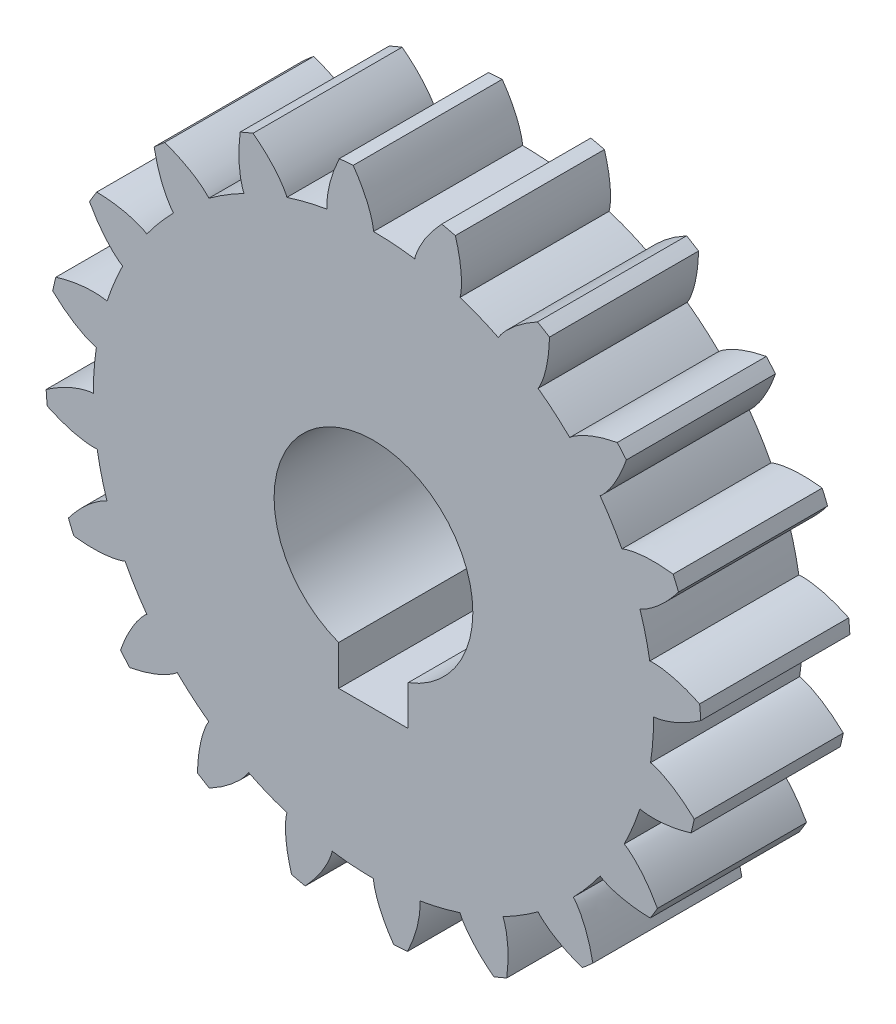
from build123d import *

# Parameters (mm, degrees)
BOSS_EXTRUDE1_DEPTH = 15


with BuildPart() as part:
    # Sketch2 → Boss-Extrude1 (new body)
    with BuildSketch(Plane.XY):
        with BuildLine():
            ThreePointArc((-4.15371806, -27.882301309), (-2.082549652, -28.112970084), (0, -28.19))
            add(Edge.make_bspline(
                [(0, -28.19), (0.00050941, -28.212977148), (0.003524206, -28.277366151), (0.015448979, -28.398790812), (0.043740646, -28.596006057), (0.115099943, -28.959915934), (0.262171531, -29.504037494), (0.472121052, -30.090958528), (0.736277742, -30.698626173), (0.995999295, -31.222666633), (1.218164991, -31.634423263), (1.500300211, -32.118998732), (1.738231713, -32.493616494), (1.920656813, -32.7647313), (2.040591108, -32.936848482)],
                knots=[0, 0, 0, 0, 0, 0.005376748, 0.015083688, 0.02853182, 0.046610139, 0.092110525, 0.146842495, 0.174208853, 0.201574955, 0.228941013, 0.256307345, 0.305396491, 0.305396491, 0.305396491, 0.305396491, 0.305396491], degree=4))
            ThreePointArc((2.040591108, -32.936848482), (2.740354915, -32.886022182), (3.438880021, -32.820330653))
            add(Edge.make_bspline(
                [(4.665684319, -27.801213819), (4.668984848, -27.823958387), (4.676668557, -27.887958335), (4.685005058, -28.009682002), (4.689744378, -28.208859838), (4.679599416, -28.579561371), (4.624612923, -29.140520203), (4.514699363, -29.754095064), (4.354759979, -30.397102154), (4.185353556, -30.956901361), (4.034401106, -31.399749503), (3.836358346, -31.924337658), (3.663710728, -32.333168513), (3.52867337, -32.630737105), (3.438880021, -32.820330653)],
                knots=[0, 0, 0, 0, 0, 0.005376748, 0.015083688, 0.02853182, 0.046610139, 0.092110525, 0.146842495, 0.174208853, 0.201574955, 0.228941013, 0.256307345, 0.305396491, 0.305396491, 0.305396491, 0.305396491, 0.305396491], degree=4))
            ThreePointArc((4.665684319, -27.801213819), (6.706763102, -27.380566625), (8.711189071, -26.810283194))
            add(Edge.make_bspline(
                [(8.711189071, -26.810283194), (8.718773878, -26.831978344), (8.741538416, -26.892284302), (8.790401833, -27.004081059), (8.878251669, -27.182901298), (9.05857273, -27.506948922), (9.366588932, -27.978991658), (9.747631365, -28.472308761), (10.186638936, -28.968606128), (10.595586219, -29.386739849), (10.934118148, -29.709690699), (11.352186743, -30.083364779), (11.694236303, -30.366122565), (11.951511966, -30.567595612), (12.118763392, -30.694227044)],
                knots=[0, 0, 0, 0, 0, 0.005376748, 0.015083688, 0.02853182, 0.046610139, 0.092110525, 0.146842495, 0.174208853, 0.201574955, 0.228941013, 0.256307345, 0.305396491, 0.305396491, 0.305396491, 0.305396491, 0.305396491], degree=4))
            ThreePointArc((12.118763392, -30.694227044), (12.768572131, -30.429649451), (13.412609185, -30.151316967))
            add(Edge.make_bspline(
                [(13.028377009, -24.998749819), (13.038544456, -25.019361268), (13.065629169, -25.077854439), (13.111172335, -25.191044406), (13.177229032, -25.379009254), (13.282133674, -25.734702329), (13.403184223, -26.285197642), (13.488255275, -26.90270717), (13.534844, -27.56366724), (13.546716386, -28.148417387), (13.539999676, -28.616237871), (13.513756474, -29.176349433), (13.475894514, -29.618521729), (13.439420107, -29.943255116), (13.412609185, -30.151316967)],
                knots=[0, 0, 0, 0, 0, 0.005376748, 0.015083688, 0.02853182, 0.046610139, 0.092110525, 0.146842495, 0.174208853, 0.201574955, 0.228941013, 0.256307345, 0.305396491, 0.305396491, 0.305396491, 0.305396491, 0.305396491], degree=4))
            ThreePointArc((13.028377009, -24.998749819), (14.839571154, -23.967962533), (16.569666262, -22.806189071))
            add(Edge.make_bspline(
                [(16.569666262, -22.806189071), (16.583584012, -22.824478551), (16.62386994, -22.874798296), (16.704888909, -22.966023704), (16.843697561, -23.108944765), (17.115329303, -23.361410097), (17.554139346, -23.715167176), (18.068975605, -24.066591035), (18.639860936, -24.402937079), (19.15800334, -24.674234219), (19.579763639, -24.87676661), (20.09284214, -25.102961479), (20.505527565, -25.266180987), (20.812469856, -25.378290689), (21.010666679, -25.447040804)],
                knots=[0, 0, 0, 0, 0, 0.005376748, 0.015083688, 0.02853182, 0.046610139, 0.092110525, 0.146842495, 0.174208853, 0.201574955, 0.228941013, 0.256307345, 0.305396491, 0.305396491, 0.305396491, 0.305396491, 0.305396491], degree=4))
            ThreePointArc((21.010666679, -25.447040804), (21.546912542, -24.994610617), (22.073418712, -24.530882299))
            add(Edge.make_bspline(
                [(20.115761383, -19.74923401), (20.131800488, -19.765694749), (20.175634965, -19.812955423), (20.253926713, -19.906531867), (20.374834697, -20.064884419), (20.584520146, -20.370751318), (20.869758466, -20.856896796), (21.141486783, -21.417894855), (21.390043188, -22.032108529), (21.582032231, -22.584570198), (21.72020874, -23.031569495), (21.868333963, -23.572376841), (21.968963853, -24.004607674), (22.034622766, -24.32471869), (22.073418712, -24.530882299)],
                knots=[0, 0, 0, 0, 0, 0.005376748, 0.015083688, 0.02853182, 0.046610139, 0.092110525, 0.146842495, 0.174208853, 0.201574955, 0.228941013, 0.256307345, 0.305396491, 0.305396491, 0.305396491, 0.305396491, 0.305396491], degree=4))
            ThreePointArc((20.115761383, -19.74923401), (21.519778588, -18.209207273), (22.806189071, -16.569666262))
            add(Edge.make_bspline(
                [(22.806189071, -16.569666262), (22.825077398, -16.58275977), (22.878941249, -16.618167654), (22.984185069, -16.679891935), (23.160364978, -16.772923709), (23.496718195, -16.929093684), (24.023368295, -17.129936898), (24.621602618, -17.305067696), (25.268483476, -17.448538524), (25.845101612, -17.546442628), (26.308805444, -17.608731279), (26.866670155, -17.665305406), (27.309594919, -17.693009573), (27.636158188, -17.704781852), (27.845899522, -17.70892091)],
                knots=[0, 0, 0, 0, 0, 0.005376748, 0.015083688, 0.02853182, 0.046610139, 0.092110525, 0.146842495, 0.174208853, 0.201574955, 0.228941013, 0.256307345, 0.305396491, 0.305396491, 0.305396491, 0.305396491, 0.305396491], degree=4))
            ThreePointArc((27.845899522, -17.70892091), (28.216091028, -17.112925148), (28.57352822, -16.509193955))
            add(Edge.make_bspline(
                [(25.234074879, -12.566525574), (25.254415622, -12.577224312), (25.310709039, -12.608626286), (25.414085627, -12.673429291), (25.578009583, -12.786668896), (25.871950365, -13.012769237), (26.293455343, -13.386977573), (26.725242263, -13.836549765), (27.151435915, -14.343893529), (27.50474839, -14.809987922), (27.774292439, -15.192410627), (28.082286558, -15.660975766), (28.311557943, -16.04095537), (28.472923024, -16.325109318), (28.57352822, -16.509193955)],
                knots=[0, 0, 0, 0, 0, 0.005376748, 0.015083688, 0.02853182, 0.046610139, 0.092110525, 0.146842495, 0.174208853, 0.201574955, 0.228941013, 0.256307345, 0.305396491, 0.305396491, 0.305396491, 0.305396491, 0.305396491], degree=4))
            ThreePointArc((25.234074879, -12.566525574), (26.093480157, -10.668007935), (26.810283194, -8.711189071))
            add(Edge.make_bspline(
                [(26.810283194, -8.711189071), (26.832293177, -8.717804923), (26.894462381, -8.734834977), (27.013629054, -8.761016128), (27.209934504, -8.795052017), (27.578084598, -8.839639629), (28.141022575, -8.867909045), (28.764095618, -8.849603759), (29.423650798, -8.786155447), (30.002301266, -8.70108298), (30.462558068, -8.617030642), (31.010601303, -8.498446158), (31.440408845, -8.387923108), (31.754626804, -8.29820561), (31.955381706, -8.237328452)],
                knots=[0, 0, 0, 0, 0, 0.005376748, 0.015083688, 0.02853182, 0.046610139, 0.092110525, 0.146842495, 0.174208853, 0.201574955, 0.228941013, 0.256307345, 0.305396491, 0.305396491, 0.305396491, 0.305396491, 0.305396491], degree=4))
            ThreePointArc((31.955381706, -8.237328452), (32.12328193, -7.556107332), (32.276661703, -6.871470681))
            add(Edge.make_bspline(
                [(27.882301309, -4.15371806), (27.904952597, -4.157607528), (27.968194561, -4.170076958), (28.086536769, -4.199763156), (28.277430678, -4.256805132), (28.626853822, -4.381006637), (29.143365613, -4.606647712), (29.692944825, -4.900786779), (30.25505692, -5.25159829), (30.73510814, -5.585700841), (31.109634878, -5.866112755), (31.547349284, -6.216569267), (31.882819484, -6.507102591), (32.124095194, -6.727484502), (32.276661703, -6.871470681)],
                knots=[0, 0, 0, 0, 0, 0.005376748, 0.015083688, 0.02853182, 0.046610139, 0.092110525, 0.146842495, 0.174208853, 0.201574955, 0.228941013, 0.256307345, 0.305396491, 0.305396491, 0.305396491, 0.305396491, 0.305396491], degree=4))
            ThreePointArc((27.882301309, -4.15371806), (28.112970084, -2.082549652), (28.19, 0))
            add(Edge.make_bspline(
                [(28.19, 0), (28.212977148, 0.00050941), (28.277366151, 0.003524206), (28.398790812, 0.015448979), (28.596006057, 0.043740646), (28.959915934, 0.115099943), (29.504037494, 0.262171531), (30.090958528, 0.472121052), (30.698626173, 0.736277742), (31.222666633, 0.995999295), (31.634423263, 1.218164991), (32.118998732, 1.500300211), (32.493616494, 1.738231713), (32.7647313, 1.920656813), (32.936848482, 2.040591108)],
                knots=[0, 0, 0, 0, 0, 0.005376748, 0.015083688, 0.02853182, 0.046610139, 0.092110525, 0.146842495, 0.174208853, 0.201574955, 0.228941013, 0.256307345, 0.305396491, 0.305396491, 0.305396491, 0.305396491, 0.305396491], degree=4))
            ThreePointArc((32.936848482, 2.040591108), (32.886022182, 2.740354915), (32.820330653, 3.438880021))
            add(Edge.make_bspline(
                [(27.801213819, 4.665684319), (27.823958387, 4.668984848), (27.887958335, 4.676668557), (28.009682002, 4.685005058), (28.208859838, 4.689744378), (28.579561371, 4.679599416), (29.140520203, 4.624612923), (29.754095064, 4.514699363), (30.397102154, 4.354759979), (30.956901361, 4.185353556), (31.399749503, 4.034401106), (31.924337658, 3.836358346), (32.333168513, 3.663710728), (32.630737105, 3.52867337), (32.820330653, 3.438880021)],
                knots=[0, 0, 0, 0, 0, 0.005376748, 0.015083688, 0.02853182, 0.046610139, 0.092110525, 0.146842495, 0.174208853, 0.201574955, 0.228941013, 0.256307345, 0.305396491, 0.305396491, 0.305396491, 0.305396491, 0.305396491], degree=4))
            ThreePointArc((27.801213819, 4.665684319), (27.380566625, 6.706763102), (26.810283194, 8.711189071))
            add(Edge.make_bspline(
                [(26.810283194, 8.711189071), (26.831978344, 8.718773878), (26.892284302, 8.741538416), (27.004081059, 8.790401833), (27.182901298, 8.878251669), (27.506948922, 9.05857273), (27.978991658, 9.366588932), (28.472308761, 9.747631365), (28.968606128, 10.186638936), (29.386739849, 10.595586219), (29.709690699, 10.934118148), (30.083364779, 11.352186743), (30.366122565, 11.694236303), (30.567595612, 11.951511966), (30.694227044, 12.118763392)],
                knots=[0, 0, 0, 0, 0, 0.005376748, 0.015083688, 0.02853182, 0.046610139, 0.092110525, 0.146842495, 0.174208853, 0.201574955, 0.228941013, 0.256307345, 0.305396491, 0.305396491, 0.305396491, 0.305396491, 0.305396491], degree=4))
            ThreePointArc((30.694227044, 12.118763392), (30.429649451, 12.768572131), (30.151316967, 13.412609185))
            add(Edge.make_bspline(
                [(24.998749819, 13.028377009), (25.019361268, 13.038544456), (25.077854439, 13.065629169), (25.191044406, 13.111172335), (25.379009254, 13.177229032), (25.734702329, 13.282133674), (26.285197642, 13.403184223), (26.90270717, 13.488255275), (27.56366724, 13.534844), (28.148417387, 13.546716386), (28.616237871, 13.539999676), (29.176349433, 13.513756474), (29.618521729, 13.475894514), (29.943255116, 13.439420107), (30.151316967, 13.412609185)],
                knots=[0, 0, 0, 0, 0, 0.005376748, 0.015083688, 0.02853182, 0.046610139, 0.092110525, 0.146842495, 0.174208853, 0.201574955, 0.228941013, 0.256307345, 0.305396491, 0.305396491, 0.305396491, 0.305396491, 0.305396491], degree=4))
            ThreePointArc((24.998749819, 13.028377009), (23.967962533, 14.839571154), (22.806189071, 16.569666262))
            add(Edge.make_bspline(
                [(22.806189071, 16.569666262), (22.824478551, 16.583584012), (22.874798296, 16.62386994), (22.966023704, 16.704888909), (23.108944765, 16.843697561), (23.361410097, 17.115329303), (23.715167176, 17.554139346), (24.066591035, 18.068975605), (24.402937079, 18.639860936), (24.674234219, 19.15800334), (24.87676661, 19.579763639), (25.102961479, 20.09284214), (25.266180987, 20.505527565), (25.378290689, 20.812469856), (25.447040804, 21.010666679)],
                knots=[0, 0, 0, 0, 0, 0.005376748, 0.015083688, 0.02853182, 0.046610139, 0.092110525, 0.146842495, 0.174208853, 0.201574955, 0.228941013, 0.256307345, 0.305396491, 0.305396491, 0.305396491, 0.305396491, 0.305396491], degree=4))
            ThreePointArc((25.447040804, 21.010666679), (24.994610617, 21.546912542), (24.530882299, 22.073418712))
            add(Edge.make_bspline(
                [(19.74923401, 20.115761383), (19.765694749, 20.131800488), (19.812955423, 20.175634965), (19.906531867, 20.253926713), (20.064884419, 20.374834697), (20.370751318, 20.584520146), (20.856896796, 20.869758466), (21.417894855, 21.141486783), (22.032108529, 21.390043188), (22.584570198, 21.582032231), (23.031569495, 21.72020874), (23.572376841, 21.868333963), (24.004607674, 21.968963853), (24.32471869, 22.034622766), (24.530882299, 22.073418712)],
                knots=[0, 0, 0, 0, 0, 0.005376748, 0.015083688, 0.02853182, 0.046610139, 0.092110525, 0.146842495, 0.174208853, 0.201574955, 0.228941013, 0.256307345, 0.305396491, 0.305396491, 0.305396491, 0.305396491, 0.305396491], degree=4))
            ThreePointArc((19.74923401, 20.115761383), (18.209207273, 21.519778588), (16.569666262, 22.806189071))
            add(Edge.make_bspline(
                [(16.569666262, 22.806189071), (16.58275977, 22.825077398), (16.618167654, 22.878941249), (16.679891935, 22.984185069), (16.772923709, 23.160364978), (16.929093684, 23.496718195), (17.129936898, 24.023368295), (17.305067696, 24.621602618), (17.448538524, 25.268483476), (17.546442628, 25.845101612), (17.608731279, 26.308805444), (17.665305406, 26.866670155), (17.693009573, 27.309594919), (17.704781852, 27.636158188), (17.70892091, 27.845899522)],
                knots=[0, 0, 0, 0, 0, 0.005376748, 0.015083688, 0.02853182, 0.046610139, 0.092110525, 0.146842495, 0.174208853, 0.201574955, 0.228941013, 0.256307345, 0.305396491, 0.305396491, 0.305396491, 0.305396491, 0.305396491], degree=4))
            ThreePointArc((17.70892091, 27.845899522), (17.112925148, 28.216091028), (16.509193955, 28.57352822))
            add(Edge.make_bspline(
                [(12.566525574, 25.234074879), (12.577224312, 25.254415622), (12.608626286, 25.310709039), (12.673429291, 25.414085627), (12.786668896, 25.578009583), (13.012769237, 25.871950365), (13.386977573, 26.293455343), (13.836549765, 26.725242263), (14.343893529, 27.151435915), (14.809987922, 27.50474839), (15.192410627, 27.774292439), (15.660975766, 28.082286558), (16.04095537, 28.311557943), (16.325109318, 28.472923024), (16.509193955, 28.57352822)],
                knots=[0, 0, 0, 0, 0, 0.005376748, 0.015083688, 0.02853182, 0.046610139, 0.092110525, 0.146842495, 0.174208853, 0.201574955, 0.228941013, 0.256307345, 0.305396491, 0.305396491, 0.305396491, 0.305396491, 0.305396491], degree=4))
            ThreePointArc((12.566525574, 25.234074879), (10.668007935, 26.093480157), (8.711189071, 26.810283194))
            add(Edge.make_bspline(
                [(8.711189071, 26.810283194), (8.717804923, 26.832293177), (8.734834977, 26.894462381), (8.761016128, 27.013629054), (8.795052017, 27.209934504), (8.839639629, 27.578084598), (8.867909045, 28.141022575), (8.849603759, 28.764095618), (8.786155447, 29.423650798), (8.70108298, 30.002301266), (8.617030642, 30.462558068), (8.498446158, 31.010601303), (8.387923108, 31.440408845), (8.29820561, 31.754626804), (8.237328452, 31.955381706)],
                knots=[0, 0, 0, 0, 0, 0.005376748, 0.015083688, 0.02853182, 0.046610139, 0.092110525, 0.146842495, 0.174208853, 0.201574955, 0.228941013, 0.256307345, 0.305396491, 0.305396491, 0.305396491, 0.305396491, 0.305396491], degree=4))
            ThreePointArc((8.237328452, 31.955381706), (7.556107332, 32.12328193), (6.871470681, 32.276661703))
            add(Edge.make_bspline(
                [(4.15371806, 27.882301309), (4.157607528, 27.904952597), (4.170076958, 27.968194561), (4.199763156, 28.086536769), (4.256805132, 28.277430678), (4.381006637, 28.626853822), (4.606647712, 29.143365613), (4.900786779, 29.692944825), (5.25159829, 30.25505692), (5.585700841, 30.73510814), (5.866112755, 31.109634878), (6.216569267, 31.547349284), (6.507102591, 31.882819484), (6.727484502, 32.124095194), (6.871470681, 32.276661703)],
                knots=[0, 0, 0, 0, 0, 0.005376748, 0.015083688, 0.02853182, 0.046610139, 0.092110525, 0.146842495, 0.174208853, 0.201574955, 0.228941013, 0.256307345, 0.305396491, 0.305396491, 0.305396491, 0.305396491, 0.305396491], degree=4))
            ThreePointArc((4.15371806, 27.882301309), (2.082549652, 28.112970084), (0, 28.19))
            add(Edge.make_bspline(
                [(0, 28.19), (-0.00050941, 28.212977148), (-0.003524206, 28.277366151), (-0.015448979, 28.398790812), (-0.043740646, 28.596006057), (-0.115099943, 28.959915934), (-0.262171531, 29.504037494), (-0.472121052, 30.090958528), (-0.736277742, 30.698626173), (-0.995999295, 31.222666633), (-1.218164991, 31.634423263), (-1.500300211, 32.118998732), (-1.738231713, 32.493616494), (-1.920656813, 32.7647313), (-2.040591108, 32.936848482)],
                knots=[0, 0, 0, 0, 0, 0.005376748, 0.015083688, 0.02853182, 0.046610139, 0.092110525, 0.146842495, 0.174208853, 0.201574955, 0.228941013, 0.256307345, 0.305396491, 0.305396491, 0.305396491, 0.305396491, 0.305396491], degree=4))
            ThreePointArc((-2.040591108, 32.936848482), (-2.740354915, 32.886022182), (-3.438880021, 32.820330653))
            add(Edge.make_bspline(
                [(-4.665684319, 27.801213819), (-4.668984848, 27.823958387), (-4.676668557, 27.887958335), (-4.685005058, 28.009682002), (-4.689744378, 28.208859838), (-4.679599416, 28.579561371), (-4.624612923, 29.140520203), (-4.514699363, 29.754095064), (-4.354759979, 30.397102154), (-4.185353556, 30.956901361), (-4.034401106, 31.399749503), (-3.836358346, 31.924337658), (-3.663710728, 32.333168513), (-3.52867337, 32.630737105), (-3.438880021, 32.820330653)],
                knots=[0, 0, 0, 0, 0, 0.005376748, 0.015083688, 0.02853182, 0.046610139, 0.092110525, 0.146842495, 0.174208853, 0.201574955, 0.228941013, 0.256307345, 0.305396491, 0.305396491, 0.305396491, 0.305396491, 0.305396491], degree=4))
            ThreePointArc((-4.665684319, 27.801213819), (-6.706763102, 27.380566625), (-8.711189071, 26.810283194))
            add(Edge.make_bspline(
                [(-8.711189071, 26.810283194), (-8.718773878, 26.831978344), (-8.741538416, 26.892284302), (-8.790401833, 27.004081059), (-8.878251669, 27.182901298), (-9.05857273, 27.506948922), (-9.366588932, 27.978991658), (-9.747631365, 28.472308761), (-10.186638936, 28.968606128), (-10.595586219, 29.386739849), (-10.934118148, 29.709690699), (-11.352186743, 30.083364779), (-11.694236303, 30.366122565), (-11.951511966, 30.567595612), (-12.118763392, 30.694227044)],
                knots=[0, 0, 0, 0, 0, 0.005376748, 0.015083688, 0.02853182, 0.046610139, 0.092110525, 0.146842495, 0.174208853, 0.201574955, 0.228941013, 0.256307345, 0.305396491, 0.305396491, 0.305396491, 0.305396491, 0.305396491], degree=4))
            ThreePointArc((-12.118763392, 30.694227044), (-12.768572131, 30.429649451), (-13.412609185, 30.151316967))
            add(Edge.make_bspline(
                [(-13.028377009, 24.998749819), (-13.038544456, 25.019361268), (-13.065629169, 25.077854439), (-13.111172335, 25.191044406), (-13.177229032, 25.379009254), (-13.282133674, 25.734702329), (-13.403184223, 26.285197642), (-13.488255275, 26.90270717), (-13.534844, 27.56366724), (-13.546716386, 28.148417387), (-13.539999676, 28.616237871), (-13.513756474, 29.176349433), (-13.475894514, 29.618521729), (-13.439420107, 29.943255116), (-13.412609185, 30.151316967)],
                knots=[0, 0, 0, 0, 0, 0.005376748, 0.015083688, 0.02853182, 0.046610139, 0.092110525, 0.146842495, 0.174208853, 0.201574955, 0.228941013, 0.256307345, 0.305396491, 0.305396491, 0.305396491, 0.305396491, 0.305396491], degree=4))
            ThreePointArc((-13.028377009, 24.998749819), (-14.839571154, 23.967962533), (-16.569666262, 22.806189071))
            add(Edge.make_bspline(
                [(-16.569666262, 22.806189071), (-16.583584012, 22.824478551), (-16.62386994, 22.874798296), (-16.704888909, 22.966023704), (-16.843697561, 23.108944765), (-17.115329303, 23.361410097), (-17.554139346, 23.715167176), (-18.068975605, 24.066591035), (-18.639860936, 24.402937079), (-19.15800334, 24.674234219), (-19.579763639, 24.87676661), (-20.09284214, 25.102961479), (-20.505527565, 25.266180987), (-20.812469856, 25.378290689), (-21.010666679, 25.447040804)],
                knots=[0, 0, 0, 0, 0, 0.005376748, 0.015083688, 0.02853182, 0.046610139, 0.092110525, 0.146842495, 0.174208853, 0.201574955, 0.228941013, 0.256307345, 0.305396491, 0.305396491, 0.305396491, 0.305396491, 0.305396491], degree=4))
            ThreePointArc((-21.010666679, 25.447040804), (-21.546912542, 24.994610617), (-22.073418712, 24.530882299))
            add(Edge.make_bspline(
                [(-20.115761383, 19.74923401), (-20.131800488, 19.765694749), (-20.175634965, 19.812955423), (-20.253926713, 19.906531867), (-20.374834697, 20.064884419), (-20.584520146, 20.370751318), (-20.869758466, 20.856896796), (-21.141486783, 21.417894855), (-21.390043188, 22.032108529), (-21.582032231, 22.584570198), (-21.72020874, 23.031569495), (-21.868333963, 23.572376841), (-21.968963853, 24.004607674), (-22.034622766, 24.32471869), (-22.073418712, 24.530882299)],
                knots=[0, 0, 0, 0, 0, 0.005376748, 0.015083688, 0.02853182, 0.046610139, 0.092110525, 0.146842495, 0.174208853, 0.201574955, 0.228941013, 0.256307345, 0.305396491, 0.305396491, 0.305396491, 0.305396491, 0.305396491], degree=4))
            ThreePointArc((-20.115761383, 19.74923401), (-21.519778588, 18.209207273), (-22.806189071, 16.569666262))
            add(Edge.make_bspline(
                [(-22.806189071, 16.569666262), (-22.825077398, 16.58275977), (-22.878941249, 16.618167654), (-22.984185069, 16.679891935), (-23.160364978, 16.772923709), (-23.496718195, 16.929093684), (-24.023368295, 17.129936898), (-24.621602618, 17.305067696), (-25.268483476, 17.448538524), (-25.845101612, 17.546442628), (-26.308805444, 17.608731279), (-26.866670155, 17.665305406), (-27.309594919, 17.693009573), (-27.636158188, 17.704781852), (-27.845899522, 17.70892091)],
                knots=[0, 0, 0, 0, 0, 0.005376748, 0.015083688, 0.02853182, 0.046610139, 0.092110525, 0.146842495, 0.174208853, 0.201574955, 0.228941013, 0.256307345, 0.305396491, 0.305396491, 0.305396491, 0.305396491, 0.305396491], degree=4))
            ThreePointArc((-27.845899522, 17.70892091), (-28.216091028, 17.112925148), (-28.57352822, 16.509193955))
            add(Edge.make_bspline(
                [(-25.234074879, 12.566525574), (-25.254415622, 12.577224312), (-25.310709039, 12.608626286), (-25.414085627, 12.673429291), (-25.578009583, 12.786668896), (-25.871950365, 13.012769237), (-26.293455343, 13.386977573), (-26.725242263, 13.836549765), (-27.151435915, 14.343893529), (-27.50474839, 14.809987922), (-27.774292439, 15.192410627), (-28.082286558, 15.660975766), (-28.311557943, 16.04095537), (-28.472923024, 16.325109318), (-28.57352822, 16.509193955)],
                knots=[0, 0, 0, 0, 0, 0.005376748, 0.015083688, 0.02853182, 0.046610139, 0.092110525, 0.146842495, 0.174208853, 0.201574955, 0.228941013, 0.256307345, 0.305396491, 0.305396491, 0.305396491, 0.305396491, 0.305396491], degree=4))
            ThreePointArc((-25.234074879, 12.566525574), (-26.093480157, 10.668007935), (-26.810283194, 8.711189071))
            add(Edge.make_bspline(
                [(-26.810283194, 8.711189071), (-26.832293177, 8.717804923), (-26.894462381, 8.734834977), (-27.013629054, 8.761016128), (-27.209934504, 8.795052017), (-27.578084598, 8.839639629), (-28.141022575, 8.867909045), (-28.764095618, 8.849603759), (-29.423650798, 8.786155447), (-30.002301266, 8.70108298), (-30.462558068, 8.617030642), (-31.010601303, 8.498446158), (-31.440408845, 8.387923108), (-31.754626804, 8.29820561), (-31.955381706, 8.237328452)],
                knots=[0, 0, 0, 0, 0, 0.005376748, 0.015083688, 0.02853182, 0.046610139, 0.092110525, 0.146842495, 0.174208853, 0.201574955, 0.228941013, 0.256307345, 0.305396491, 0.305396491, 0.305396491, 0.305396491, 0.305396491], degree=4))
            ThreePointArc((-31.955381706, 8.237328452), (-32.12328193, 7.556107332), (-32.276661703, 6.871470681))
            add(Edge.make_bspline(
                [(-27.882301309, 4.15371806), (-27.904952597, 4.157607528), (-27.968194561, 4.170076958), (-28.086536769, 4.199763156), (-28.277430678, 4.256805132), (-28.626853822, 4.381006637), (-29.143365613, 4.606647712), (-29.692944825, 4.900786779), (-30.25505692, 5.25159829), (-30.73510814, 5.585700841), (-31.109634878, 5.866112755), (-31.547349284, 6.216569267), (-31.882819484, 6.507102591), (-32.124095194, 6.727484502), (-32.276661703, 6.871470681)],
                knots=[0, 0, 0, 0, 0, 0.005376748, 0.015083688, 0.02853182, 0.046610139, 0.092110525, 0.146842495, 0.174208853, 0.201574955, 0.228941013, 0.256307345, 0.305396491, 0.305396491, 0.305396491, 0.305396491, 0.305396491], degree=4))
            ThreePointArc((-27.882301309, 4.15371806), (-28.112970084, 2.082549652), (-28.19, 0))
            add(Edge.make_bspline(
                [(-28.19, 0), (-28.212977148, -0.00050941), (-28.277366151, -0.003524206), (-28.398790812, -0.015448979), (-28.596006057, -0.043740646), (-28.959915934, -0.115099943), (-29.504037494, -0.262171531), (-30.090958528, -0.472121052), (-30.698626173, -0.736277742), (-31.222666633, -0.995999295), (-31.634423263, -1.218164991), (-32.118998732, -1.500300211), (-32.493616494, -1.738231713), (-32.7647313, -1.920656813), (-32.936848482, -2.040591108)],
                knots=[0, 0, 0, 0, 0, 0.005376748, 0.015083688, 0.02853182, 0.046610139, 0.092110525, 0.146842495, 0.174208853, 0.201574955, 0.228941013, 0.256307345, 0.305396491, 0.305396491, 0.305396491, 0.305396491, 0.305396491], degree=4))
            ThreePointArc((-32.936848482, -2.040591108), (-32.886022182, -2.740354915), (-32.820330653, -3.438880021))
            add(Edge.make_bspline(
                [(-27.801213819, -4.665684319), (-27.823958387, -4.668984848), (-27.887958335, -4.676668557), (-28.009682002, -4.685005058), (-28.208859838, -4.689744378), (-28.579561371, -4.679599416), (-29.140520203, -4.624612923), (-29.754095064, -4.514699363), (-30.397102154, -4.354759979), (-30.956901361, -4.185353556), (-31.399749503, -4.034401106), (-31.924337658, -3.836358346), (-32.333168513, -3.663710728), (-32.630737105, -3.52867337), (-32.820330653, -3.438880021)],
                knots=[0, 0, 0, 0, 0, 0.005376748, 0.015083688, 0.02853182, 0.046610139, 0.092110525, 0.146842495, 0.174208853, 0.201574955, 0.228941013, 0.256307345, 0.305396491, 0.305396491, 0.305396491, 0.305396491, 0.305396491], degree=4))
            ThreePointArc((-27.801213819, -4.665684319), (-27.380566625, -6.706763102), (-26.810283194, -8.711189071))
            add(Edge.make_bspline(
                [(-26.810283194, -8.711189071), (-26.831978344, -8.718773878), (-26.892284302, -8.741538416), (-27.004081059, -8.790401833), (-27.182901298, -8.878251669), (-27.506948922, -9.05857273), (-27.978991658, -9.366588932), (-28.472308761, -9.747631365), (-28.968606128, -10.186638936), (-29.386739849, -10.595586219), (-29.709690699, -10.934118148), (-30.083364779, -11.352186743), (-30.366122565, -11.694236303), (-30.567595612, -11.951511966), (-30.694227044, -12.118763392)],
                knots=[0, 0, 0, 0, 0, 0.005376748, 0.015083688, 0.02853182, 0.046610139, 0.092110525, 0.146842495, 0.174208853, 0.201574955, 0.228941013, 0.256307345, 0.305396491, 0.305396491, 0.305396491, 0.305396491, 0.305396491], degree=4))
            ThreePointArc((-30.694227044, -12.118763392), (-30.429649451, -12.768572131), (-30.151316967, -13.412609185))
            add(Edge.make_bspline(
                [(-24.998749819, -13.028377009), (-25.019361268, -13.038544456), (-25.077854439, -13.065629169), (-25.191044406, -13.111172335), (-25.379009254, -13.177229032), (-25.734702329, -13.282133674), (-26.285197642, -13.403184223), (-26.90270717, -13.488255275), (-27.56366724, -13.534844), (-28.148417387, -13.546716386), (-28.616237871, -13.539999676), (-29.176349433, -13.513756474), (-29.618521729, -13.475894514), (-29.943255116, -13.439420107), (-30.151316967, -13.412609185)],
                knots=[0, 0, 0, 0, 0, 0.005376748, 0.015083688, 0.02853182, 0.046610139, 0.092110525, 0.146842495, 0.174208853, 0.201574955, 0.228941013, 0.256307345, 0.305396491, 0.305396491, 0.305396491, 0.305396491, 0.305396491], degree=4))
            ThreePointArc((-24.998749819, -13.028377009), (-23.967962533, -14.839571154), (-22.806189071, -16.569666262))
            add(Edge.make_bspline(
                [(-22.806189071, -16.569666262), (-22.824478551, -16.583584012), (-22.874798296, -16.62386994), (-22.966023704, -16.704888909), (-23.108944765, -16.843697561), (-23.361410097, -17.115329303), (-23.715167176, -17.554139346), (-24.066591035, -18.068975605), (-24.402937079, -18.639860936), (-24.674234219, -19.15800334), (-24.87676661, -19.579763639), (-25.102961479, -20.09284214), (-25.266180987, -20.505527565), (-25.378290689, -20.812469856), (-25.447040804, -21.010666679)],
                knots=[0, 0, 0, 0, 0, 0.005376748, 0.015083688, 0.02853182, 0.046610139, 0.092110525, 0.146842495, 0.174208853, 0.201574955, 0.228941013, 0.256307345, 0.305396491, 0.305396491, 0.305396491, 0.305396491, 0.305396491], degree=4))
            ThreePointArc((-25.447040804, -21.010666679), (-24.994610617, -21.546912542), (-24.530882299, -22.073418712))
            add(Edge.make_bspline(
                [(-19.74923401, -20.115761383), (-19.765694749, -20.131800488), (-19.812955423, -20.175634965), (-19.906531867, -20.253926713), (-20.064884419, -20.374834697), (-20.370751318, -20.584520146), (-20.856896796, -20.869758466), (-21.417894855, -21.141486783), (-22.032108529, -21.390043188), (-22.584570198, -21.582032231), (-23.031569495, -21.72020874), (-23.572376841, -21.868333963), (-24.004607674, -21.968963853), (-24.32471869, -22.034622766), (-24.530882299, -22.073418712)],
                knots=[0, 0, 0, 0, 0, 0.005376748, 0.015083688, 0.02853182, 0.046610139, 0.092110525, 0.146842495, 0.174208853, 0.201574955, 0.228941013, 0.256307345, 0.305396491, 0.305396491, 0.305396491, 0.305396491, 0.305396491], degree=4))
            ThreePointArc((-19.74923401, -20.115761383), (-18.209207273, -21.519778588), (-16.569666262, -22.806189071))
            add(Edge.make_bspline(
                [(-16.569666262, -22.806189071), (-16.58275977, -22.825077398), (-16.618167654, -22.878941249), (-16.679891935, -22.984185069), (-16.772923709, -23.160364978), (-16.929093684, -23.496718195), (-17.129936898, -24.023368295), (-17.305067696, -24.621602618), (-17.448538524, -25.268483476), (-17.546442628, -25.845101612), (-17.608731279, -26.308805444), (-17.665305406, -26.866670155), (-17.693009573, -27.309594919), (-17.704781852, -27.636158188), (-17.70892091, -27.845899522)],
                knots=[0, 0, 0, 0, 0, 0.005376748, 0.015083688, 0.02853182, 0.046610139, 0.092110525, 0.146842495, 0.174208853, 0.201574955, 0.228941013, 0.256307345, 0.305396491, 0.305396491, 0.305396491, 0.305396491, 0.305396491], degree=4))
            ThreePointArc((-17.70892091, -27.845899522), (-17.112925148, -28.216091028), (-16.509193955, -28.57352822))
            add(Edge.make_bspline(
                [(-12.566525574, -25.234074879), (-12.577224312, -25.254415622), (-12.608626286, -25.310709039), (-12.673429291, -25.414085627), (-12.786668896, -25.578009583), (-13.012769237, -25.871950365), (-13.386977573, -26.293455343), (-13.836549765, -26.725242263), (-14.343893529, -27.151435915), (-14.809987922, -27.50474839), (-15.192410627, -27.774292439), (-15.660975766, -28.082286558), (-16.04095537, -28.311557943), (-16.325109318, -28.472923024), (-16.509193955, -28.57352822)],
                knots=[0, 0, 0, 0, 0, 0.005376748, 0.015083688, 0.02853182, 0.046610139, 0.092110525, 0.146842495, 0.174208853, 0.201574955, 0.228941013, 0.256307345, 0.305396491, 0.305396491, 0.305396491, 0.305396491, 0.305396491], degree=4))
            ThreePointArc((-12.566525574, -25.234074879), (-10.668007935, -26.093480157), (-8.711189071, -26.810283194))
            add(Edge.make_bspline(
                [(-8.711189071, -26.810283194), (-8.717804923, -26.832293177), (-8.734834977, -26.894462381), (-8.761016128, -27.013629054), (-8.795052017, -27.209934504), (-8.839639629, -27.578084598), (-8.867909045, -28.141022575), (-8.849603759, -28.764095618), (-8.786155447, -29.423650798), (-8.70108298, -30.002301266), (-8.617030642, -30.462558068), (-8.498446158, -31.010601303), (-8.387923108, -31.440408845), (-8.29820561, -31.754626804), (-8.237328452, -31.955381706)],
                knots=[0, 0, 0, 0, 0, 0.005376748, 0.015083688, 0.02853182, 0.046610139, 0.092110525, 0.146842495, 0.174208853, 0.201574955, 0.228941013, 0.256307345, 0.305396491, 0.305396491, 0.305396491, 0.305396491, 0.305396491], degree=4))
            ThreePointArc((-8.237328452, -31.955381706), (-7.556107332, -32.12328193), (-6.871470681, -32.276661703))
            add(Edge.make_bspline(
                [(-4.15371806, -27.882301309), (-4.157607528, -27.904952597), (-4.170076958, -27.968194561), (-4.199763156, -28.086536769), (-4.256805132, -28.277430678), (-4.381006637, -28.626853822), (-4.606647712, -29.143365613), (-4.900786779, -29.692944825), (-5.25159829, -30.25505692), (-5.585700841, -30.73510814), (-5.866112755, -31.109634878), (-6.216569267, -31.547349284), (-6.507102591, -31.882819484), (-6.727484502, -32.124095194), (-6.871470681, -32.276661703)],
                knots=[0, 0, 0, 0, 0, 0.005376748, 0.015083688, 0.02853182, 0.046610139, 0.092110525, 0.146842495, 0.174208853, 0.201574955, 0.228941013, 0.256307345, 0.305396491, 0.305396491, 0.305396491, 0.305396491, 0.305396491], degree=4))
        make_face()
        with BuildLine():
            Line((-3.5, -13.367496998), (3.5, -13.367496998))
            Line((3.5, -13.367496998), (3.5, -9.367496998))
            ThreePointArc((3.5, -9.367496998), (0, 10), (-3.5, -9.367496998))
            Line((-3.5, -9.367496998), (-3.5, -13.367496998))
        make_face(mode=Mode.SUBTRACT)
    extrude(amount=BOSS_EXTRUDE1_DEPTH)


solid = part.part
